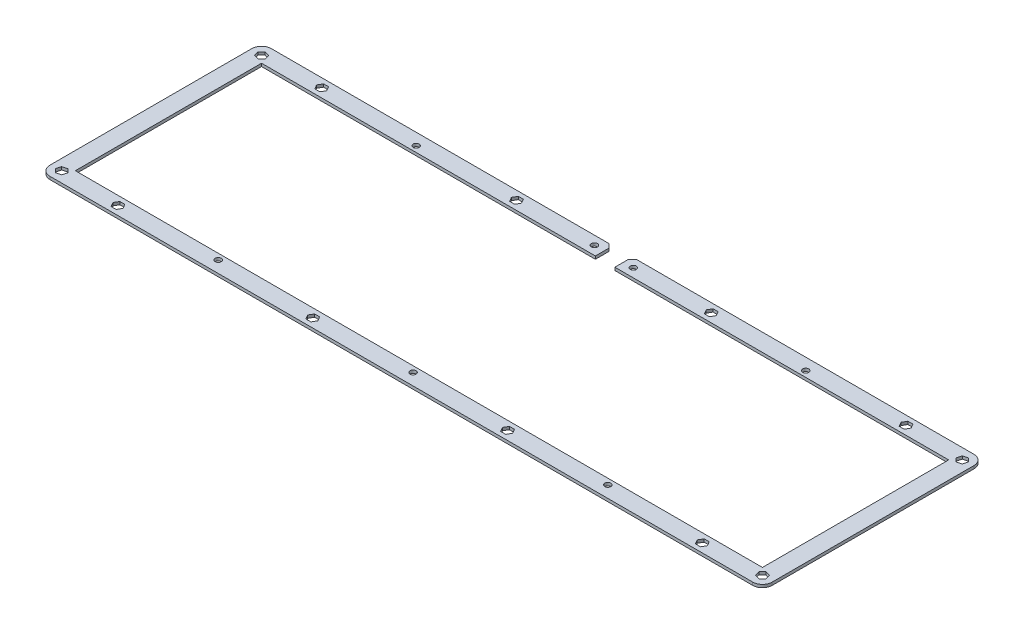
from build123d import *

# Parameters (mm, degrees)
SKETCH1_R           = 1.55
BOSS_EXTRUDE1_DEPTH = 1.5


with BuildPart() as part:
    # Sketch1 → Boss-Extrude1 (new body)
    with BuildSketch(Plane(origin=(0, 0, 0), x_dir=(1, 0, 0), z_dir=(0, 1, 0))):
        with BuildLine():
            Line((4.482e-06, 108.600000064), (4.482e-06, 5.000000064))
            ThreePointArc((4.482e-06, 5.000000064), (1.464470576, 1.464466159), (5.000004482, 6.4e-08))
            Line((5.000004482, 6.4e-08), (365.775004482, 6.4e-08))
            ThreePointArc((365.775004482, 6.4e-08), (369.310538388, 1.464466159), (370.775004482, 5.000000064))
            Line((370.775004482, 5.000000064), (370.775004482, 108.600000064))
            ThreePointArc((370.775004482, 108.600000064), (369.310538388, 112.13553397), (365.775004482, 113.600000064))
            Line((365.775004482, 113.600000064), (192.387504482, 113.600000064))
            Line((192.387504482, 113.600000064), (190.387504482, 111.600000064))
            Line((190.387504482, 111.600000064), (190.387504482, 104.600000064))
            Line((190.387504482, 104.600000064), (361.775004482, 104.600000064))
            Line((361.775004482, 104.600000064), (361.775004482, 9.000000064))
            Line((361.775004482, 9.000000064), (9.000004482, 9.000000064))
            Line((9.000004482, 9.000000064), (9.000004482, 104.600000064))
            Line((9.000004482, 104.600000064), (180.387504482, 104.600000064))
            Line((180.387504482, 104.600000064), (180.387504482, 111.600000064))
            Line((180.387504482, 111.600000064), (178.387504482, 113.600000064))
            Line((178.387504482, 113.600000064), (5.000004482, 113.600000064))
            ThreePointArc((5.000004482, 113.600000064), (1.464470576, 112.13553397), (4.482e-06, 108.600000064))
        make_face()
        with Locations(Location((195.387504482, 109.100000064, 0), (0, 0, 270))):
            Circle(SKETCH1_R, mode=Mode.SUBTRACT)
        with Locations(Location((175.387504482, 109.100000064, 0), (0, 0, 270))):
            Circle(SKETCH1_R, mode=Mode.SUBTRACT)
        with Locations(Location((85.387504482, 107.600000064, 0), (0, 0, 270))):
            Circle(SKETCH1_R, mode=Mode.SUBTRACT)
        with Locations(Location((285.387504482, 107.600000064, 0), (0, 0, 270))):
            Circle(SKETCH1_R, mode=Mode.SUBTRACT)
        with Locations(Location((85.387504482, 6.000000064, 0), (0, 0, 270))):
            Circle(SKETCH1_R, mode=Mode.SUBTRACT)
        with Locations(Location((185.387504482, 6.000000064, 0), (0, 0, 270))):
            Circle(SKETCH1_R, mode=Mode.SUBTRACT)
        with Locations(Location((285.387504482, 6.000000064, 0), (0, 0, 270))):
            Circle(SKETCH1_R, mode=Mode.SUBTRACT)
        Polygon((234.088466376, 111.350000064), (236.686542588, 111.350000064), (237.985580693, 109.100000064), (236.686542588, 106.850000064), (234.088466376, 106.850000064), (232.789428271, 109.100000064), align=None, mode=Mode.SUBTRACT)
        Polygon((334.088466376, 111.350000064), (336.686542588, 111.350000064), (337.985580693, 109.100000064), (336.686542588, 106.850000064), (334.088466376, 106.850000064), (332.789428271, 109.100000064), align=None, mode=Mode.SUBTRACT)
        Polygon((365.947436086, 110.609548976), (367.784553393, 108.772431669), (367.112121789, 106.262882757), (364.602572878, 105.590451153), (362.765455571, 107.42756846), (363.437887175, 109.937117372), align=None, mode=Mode.SUBTRACT)
        Polygon((136.686542588, 111.350000064), (134.088466376, 111.350000064), (132.789428271, 109.100000064), (134.088466376, 106.850000064), (136.686542588, 106.850000064), (137.985580693, 109.100000064), align=None, mode=Mode.SUBTRACT)
        Polygon((36.686542588, 111.350000064), (34.088466376, 111.350000064), (32.789428271, 109.100000064), (34.088466376, 106.850000064), (36.686542588, 106.850000064), (37.985580693, 109.100000064), align=None, mode=Mode.SUBTRACT)
        Polygon((4.827572878, 110.609548976), (2.990455571, 108.772431669), (3.662887175, 106.262882757), (6.172436086, 105.590451153), (8.009553393, 107.42756846), (7.337121789, 109.937117372), align=None, mode=Mode.SUBTRACT)
        Polygon((234.088466376, 2.250000064), (236.686542588, 2.250000064), (237.985580693, 4.500000064), (236.686542588, 6.750000064), (234.088466376, 6.750000064), (232.789428271, 4.500000064), align=None, mode=Mode.SUBTRACT)
        Polygon((334.088466376, 2.250000064), (336.686542588, 2.250000064), (337.985580693, 4.500000064), (336.686542588, 6.750000064), (334.088466376, 6.750000064), (332.789428271, 4.500000064), align=None, mode=Mode.SUBTRACT)
        Polygon((365.947436086, 2.990451153), (367.784553393, 4.82756846), (367.112121789, 7.337117372), (364.602572878, 8.009548976), (362.765455571, 6.172431669), (363.437887175, 3.662882757), align=None, mode=Mode.SUBTRACT)
        Polygon((136.686542588, 2.250000064), (134.088466376, 2.250000064), (132.789428271, 4.500000064), (134.088466376, 6.750000064), (136.686542588, 6.750000064), (137.985580693, 4.500000064), align=None, mode=Mode.SUBTRACT)
        Polygon((36.686542588, 2.250000064), (34.088466376, 2.250000064), (32.789428271, 4.500000064), (34.088466376, 6.750000064), (36.686542588, 6.750000064), (37.985580693, 4.500000064), align=None, mode=Mode.SUBTRACT)
        Polygon((4.827572878, 2.990451153), (2.990455571, 4.82756846), (3.662887175, 7.337117372), (6.172436086, 8.009548976), (8.009553393, 6.172431669), (7.337121789, 3.662882757), align=None, mode=Mode.SUBTRACT)
    extrude(amount=-BOSS_EXTRUDE1_DEPTH)


solid = part.part
